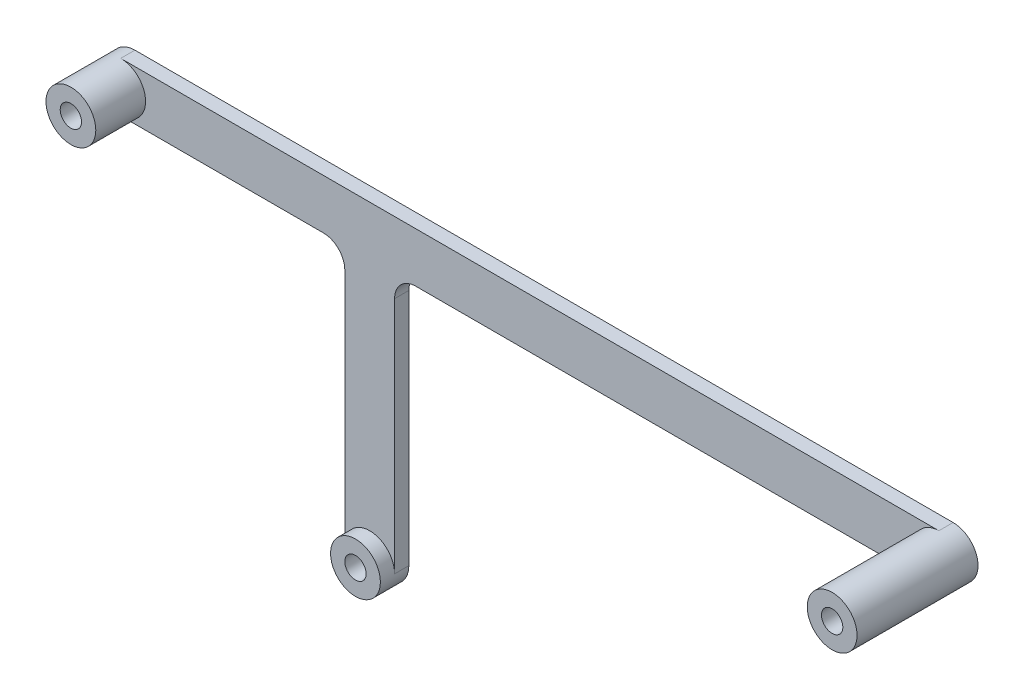
from build123d import *

# Parameters (mm, degrees)
SKETCH1_R           = 1.5
BOSS_EXTRUDE1_DEPTH = 2
SKETCH2_R           = 3.5
SKETCH2_R_2         = 1.5
BOSS_EXTRUDE2_DEPTH = 7
SKETCH3_R           = 3.5
SKETCH3_R_2         = 1.5
BOSS_EXTRUDE3_DEPTH = 15
SKETCH4_R           = 3.5
SKETCH4_R_2         = 1.5
BOSS_EXTRUDE4_DEPTH = 2


with BuildPart() as part:
    # Sketch1 → Boss-Extrude1 (new body)
    with BuildSketch(Plane.XY):
        with BuildLine():
            Line((-35, 43.5), (80, 43.5))
            ThreePointArc((80, 43.5), (83.5, 40), (80, 36.5))
            Line((80, 36.5), (6.5, 36.5))
            ThreePointArc((6.5, 36.5), (4.378679656, 35.621320344), (3.5, 33.5))
            Line((3.5, 33.5), (3.5, 0))
            ThreePointArc((3.5, 0), (0, -3.5), (-3.5, 0))
            Line((-3.5, 0), (-3.5, 33.5))
            ThreePointArc((-3.5, 33.5), (-4.378679656, 35.621320344), (-6.5, 36.5))
            Line((-6.5, 36.5), (-35, 36.5))
            ThreePointArc((-35, 36.5), (-38.5, 40), (-35, 43.5))
        make_face()
        with Locations((-35, 40)):
            Circle(SKETCH1_R, mode=Mode.SUBTRACT)
        with Locations((80, 40)):
            Circle(SKETCH1_R, mode=Mode.SUBTRACT)
        Circle(SKETCH1_R, mode=Mode.SUBTRACT)
    extrude(amount=BOSS_EXTRUDE1_DEPTH)

    # Sketch2 → Boss-Extrude2 (add)
    with BuildSketch(Plane.XY.offset(2)):
        with Locations(Location((-35, 40, 0), (0, 0, 270))):
            Circle(SKETCH2_R)
        with Locations((-35, 40)):
            Circle(SKETCH2_R_2, mode=Mode.SUBTRACT)
    extrude(amount=BOSS_EXTRUDE2_DEPTH)

    # Sketch3 → Boss-Extrude3 (add)
    with BuildSketch(Plane.XY.offset(2)):
        with Locations(Location((80, 40, 0), (0, 0, 90))):
            Circle(SKETCH3_R)
        with Locations((80, 40)):
            Circle(SKETCH3_R_2, mode=Mode.SUBTRACT)
    extrude(amount=BOSS_EXTRUDE3_DEPTH)

    # Sketch4 → Boss-Extrude4 (add)
    with BuildSketch(Plane.XY.offset(2)):
        Circle(SKETCH4_R)
        Circle(SKETCH4_R_2, mode=Mode.SUBTRACT)
    extrude(amount=BOSS_EXTRUDE4_DEPTH)


solid = part.part
